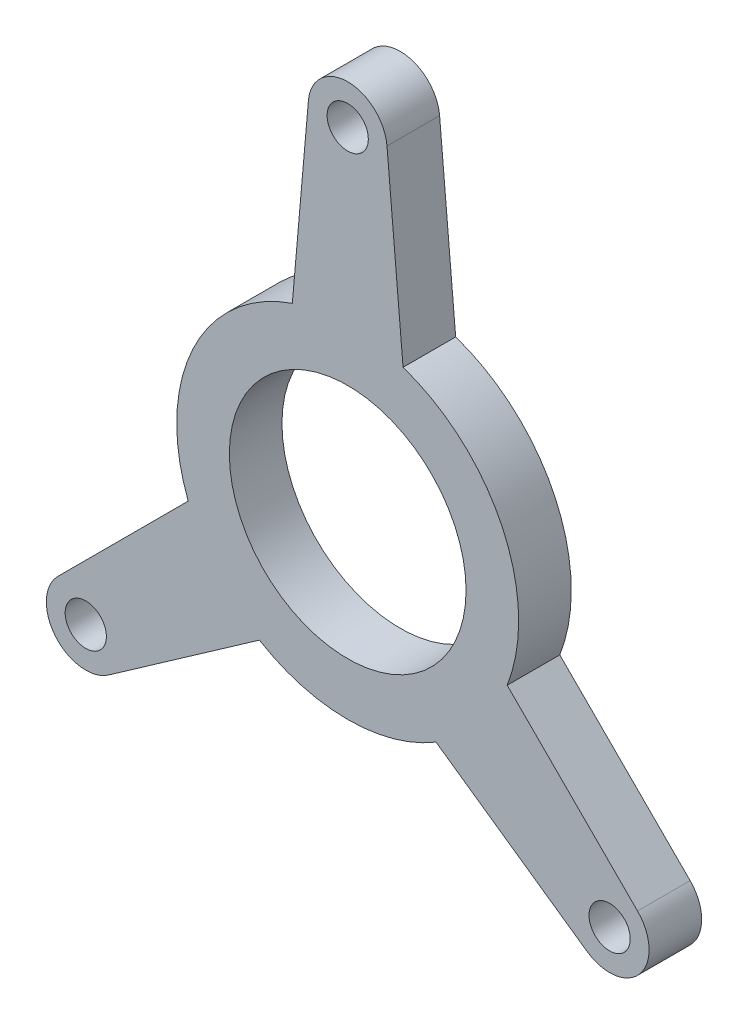
from build123d import *

# Parameters (mm, degrees)
SKETCH1_R           = 20.6375
SKETCH1_R_2         = 14.2875
SKETCH1_R_3         = 4.7625
SKETCH1_R_4         = 2.4892
BOSS_EXTRUDE1_DEPTH = 3.175


with BuildPart() as part:
    # Sketch1 → Boss-Extrude1 (new, symmetric)
    # profile 1 of 7: a face of its own
    with BuildSketch(Plane.XY):
        Circle(SKETCH1_R)
        Circle(SKETCH1_R_2, mode=Mode.SUBTRACT)
    # profile 2 of 7: a face of its own
    with BuildSketch(Plane.XY):
        with BuildLine():
            ThreePointArc((4.7625, 41.275), (-0.207737332, 36.517032845), (-4.74437725, 41.690079225))
            Line((-4.74437725, 41.690079225), (-6.68354577, 19.525281616))
            ThreePointArc((-6.68354577, 19.525281616), (0, 20.6375), (6.68354577, 19.525281616))
            Line((6.68354577, 19.525281616), (4.74437725, 41.690079225))
            ThreePointArc((4.74437725, 41.690079225), (4.757967155, 41.482737332), (4.7625, 41.275))
        make_face()
    # profile 3 of 7: a face of its own
    with BuildSketch(Plane.XY):
        with BuildLine():
            Line((34.986080435, -23.163462544), (19.253333892, -7.430716001))
            ThreePointArc((19.253333892, -7.430716001), (15.809242195, -13.265529295), (10.661133073, -17.670502196))
            Line((10.661133073, -17.670502196), (28.886826612, -30.432270201))
            ThreePointArc((28.886826612, -30.432270201), (27.970197729, -23.469782599), (34.986080435, -23.163462544))
        make_face()
    # profile 4 of 7: a face of its own
    with BuildSketch(Plane.XY):
        with BuildLine():
            ThreePointArc((-10.661133073, -17.670502196), (-15.809242195, -13.265529295), (-19.253333892, -7.430716001))
            Line((-19.253333892, -7.430716001), (-34.986080435, -23.163462544))
            ThreePointArc((-34.986080435, -23.163462544), (-29.795954543, -22.131082316), (-26.85598439, -26.53105859))
            ThreePointArc((-26.85598439, -26.53105859), (-27.394095297, -28.73013636), (-28.886826612, -30.432270201))
            Line((-28.886826612, -30.432270201), (-10.661133073, -17.670502196))
        make_face()
    # profile 5 of 7: a face of its own
    with BuildSketch(Plane.XY):
        with Locations((-31.61848439, -26.53105859)):
            Circle(SKETCH1_R_3)
        with Locations((-31.61848439, -26.53105859)):
            Circle(SKETCH1_R_4, mode=Mode.SUBTRACT)
    # profile 6 of 7: a face of its own
    with BuildSketch(Plane.XY):
        with Locations((0, 41.275)):
            Circle(SKETCH1_R_3)
        with Locations((0, 41.275)):
            Circle(SKETCH1_R_4, mode=Mode.SUBTRACT)
    # profile 7 of 7: a face of its own
    with BuildSketch(Plane.XY):
        with Locations((31.61848439, -26.53105859)):
            Circle(SKETCH1_R_3)
        with Locations((31.61848439, -26.53105859)):
            Circle(SKETCH1_R_4, mode=Mode.SUBTRACT)
    extrude(amount=BOSS_EXTRUDE1_DEPTH, both=True)


solid = part.part
